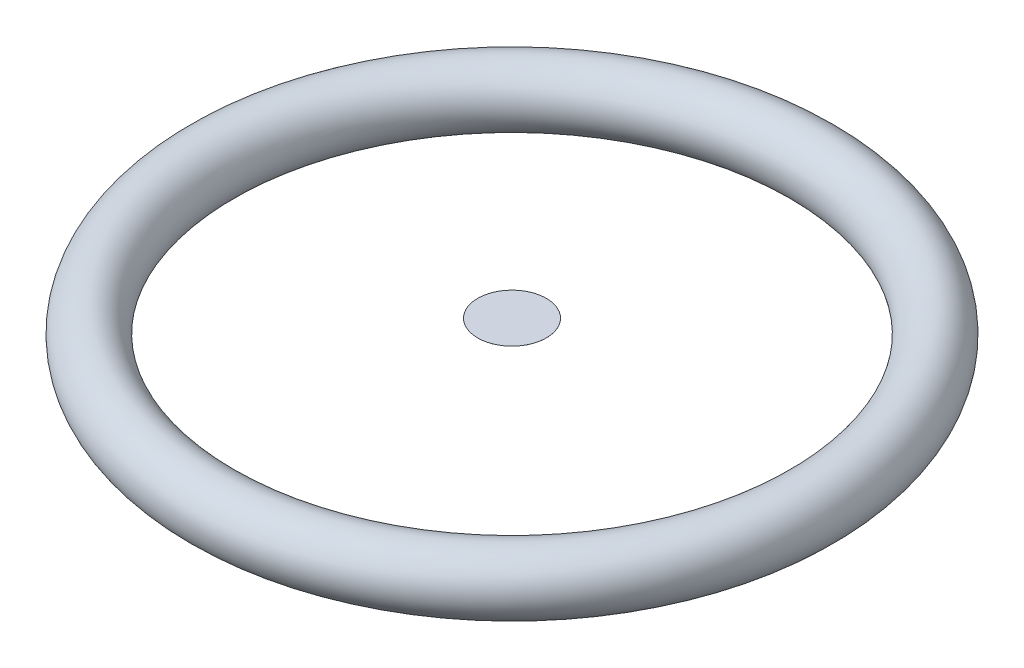
from build123d import *

# Parameters (mm, degrees)
SKETCH1_R           = 1.765
SKETCH3_R           = 2
BOSS_EXTRUDE1_DEPTH = 0.001


with BuildPart() as part:
    # Sketch1 → Revolve1 (revolve)
    with BuildSketch(Plane.XY, mode=Mode.PRIVATE) as revolve1_sk:
        with Locations((17.435, 0)):
            Circle(SKETCH1_R)
    revolve(revolve1_sk.sketch.rotate(Axis((0, 5.150017497, 0), (0, -1, 0)), 90), axis=Axis((0, 5.150017497, 0), (0, -1, 0)))


with BuildPart() as body_2:
    # Sketch3 → Boss-Extrude1 (new body)
    with BuildSketch(Plane(origin=(0, 0.8, 0), x_dir=(1, 0, 0), z_dir=(0, 1, 0))):
        with Locations(Location((0, 0, 0), (0, 0, 270))):
            Circle(SKETCH3_R)
    extrude(amount=-BOSS_EXTRUDE1_DEPTH)


solid = Compound([part.part, body_2.part])
